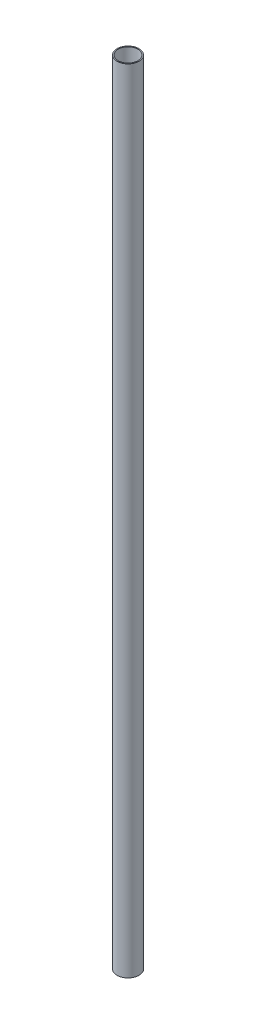
from build123d import *

# Parameters (mm, degrees)
SKETCH1_R           = 12.7
SKETCH1_R_2         = 11.5
BOSS_EXTRUDE1_DEPTH = 915


with BuildPart() as part:
    # Sketch1 → Boss-Extrude1 (new body)
    with BuildSketch(Plane(origin=(0, 0, 0), x_dir=(1, 0, 0), z_dir=(0, 1, 0))):
        with Locations(Location((0, 0, 0), (0, 0, 90))):
            Circle(SKETCH1_R)
        with Locations(Location((0, 0, 0), (0, 0, 90))):
            Circle(SKETCH1_R_2, mode=Mode.SUBTRACT)
    extrude(amount=BOSS_EXTRUDE1_DEPTH)


solid = part.part
